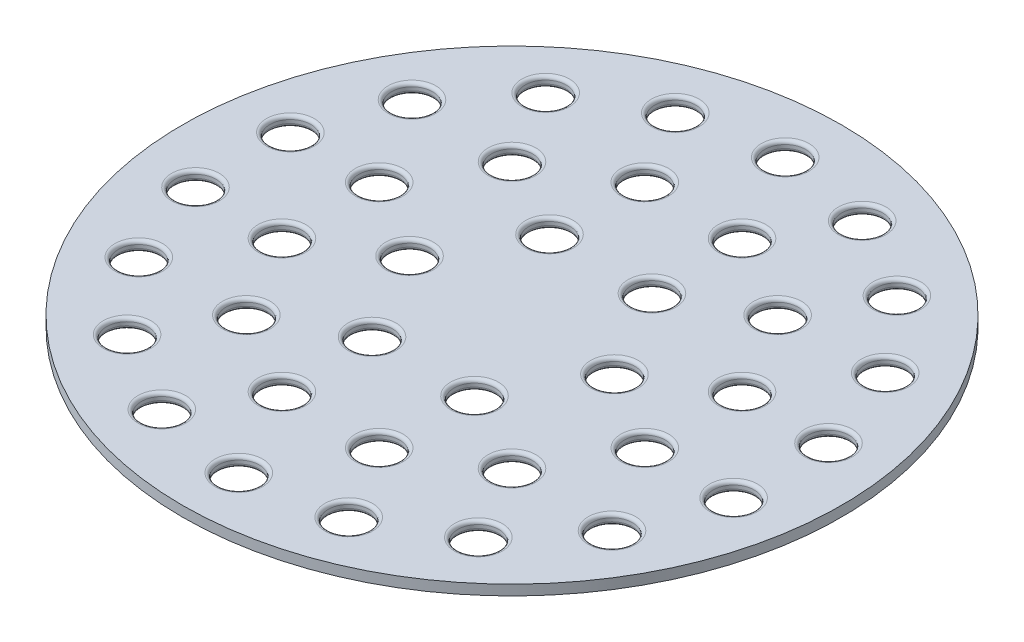
from build123d import *

# Parameters (mm, degrees)
SKETCH1_R           = 96.5
BOSS_EXTRUDE1_DEPTH = 3
SKETCH2_R           = 6
CUT_EXTRUDE3_DEPTH  = 10
FILLET1_R           = 1


with BuildPart() as part:
    # Sketch1 → Boss-Extrude1 (new body)
    with BuildSketch(Plane(origin=(0, 0, 0), x_dir=(1, 0, 0), z_dir=(0, 1, 0))):
        with Locations(Location((0, 0, 0), (0, 0, 270))):
            Circle(SKETCH1_R)
    extrude(amount=BOSS_EXTRUDE1_DEPTH)

    # Sketch2 → Cut-Extrude3 (cut)
    with BuildSketch(Plane(origin=(0, 3, 0), x_dir=(1, 0, 0), z_dir=(0, 1, 0))):
        with Locations(Location((30, 0, 0), (0, 0, 270))):
            Circle(SKETCH2_R)
        with Locations(Location((53.125920446, 14.235047481, 0), (0, 0, 270))):
            Circle(SKETCH2_R)
        with Locations(Location((78.784620241, 13.891854213, 0), (0, 0, 270))):
            Circle(SKETCH2_R)
        with Locations(Location((15, -25.980762114, 0), (0, 0, 270))):
            Circle(SKETCH2_R)
        with Locations(Location((-15, -25.980762114, 0), (0, 0, 270))):
            Circle(SKETCH2_R)
        with Locations(Location((-30, 0, 0), (0, 0, 270))):
            Circle(SKETCH2_R)
        with Locations(Location((-15, 25.980762114, 0), (0, 0, 270))):
            Circle(SKETCH2_R)
        with Locations(Location((15, 25.980762114, 0), (0, 0, 270))):
            Circle(SKETCH2_R)
        with Locations(Location((53.125920446, -14.235047481, 0), (0, 0, 270))):
            Circle(SKETCH2_R)
        with Locations(Location((38.890872965, -38.890872965, 0), (0, 0, 270))):
            Circle(SKETCH2_R)
        with Locations(Location((14.235047481, -53.125920446, 0), (0, 0, 270))):
            Circle(SKETCH2_R)
        with Locations(Location((-14.235047481, -53.125920446, 0), (0, 0, 270))):
            Circle(SKETCH2_R)
        with Locations(Location((-38.890872965, -38.890872965, 0), (0, 0, 270))):
            Circle(SKETCH2_R)
        with Locations(Location((-53.125920446, -14.235047481, 0), (0, 0, 270))):
            Circle(SKETCH2_R)
        with Locations(Location((-53.125920446, 14.235047481, 0), (0, 0, 270))):
            Circle(SKETCH2_R)
        with Locations(Location((-38.890872965, 38.890872965, 0), (0, 0, 270))):
            Circle(SKETCH2_R)
        with Locations(Location((-14.235047481, 53.125920446, 0), (0, 0, 270))):
            Circle(SKETCH2_R)
        with Locations(Location((14.235047481, 53.125920446, 0), (0, 0, 270))):
            Circle(SKETCH2_R)
        with Locations(Location((38.890872965, 38.890872965, 0), (0, 0, 270))):
            Circle(SKETCH2_R)
        with Locations(Location((78.784620241, -13.891854213, 0), (0, 0, 270))):
            Circle(SKETCH2_R)
        with Locations(Location((69.282032303, -40, 0), (0, 0, 270))):
            Circle(SKETCH2_R)
        with Locations(Location((51.423008775, -61.28355545, 0), (0, 0, 270))):
            Circle(SKETCH2_R)
        with Locations(Location((27.361611466, -75.175409663, 0), (0, 0, 270))):
            Circle(SKETCH2_R)
        with Locations(Location((0, -80, 0), (0, 0, 270))):
            Circle(SKETCH2_R)
        with Locations(Location((-27.361611466, -75.175409663, 0), (0, 0, 270))):
            Circle(SKETCH2_R)
        with Locations(Location((-51.423008775, -61.28355545, 0), (0, 0, 270))):
            Circle(SKETCH2_R)
        with Locations(Location((-69.282032303, -40, 0), (0, 0, 270))):
            Circle(SKETCH2_R)
        with Locations(Location((-78.784620241, -13.891854213, 0), (0, 0, 270))):
            Circle(SKETCH2_R)
        with Locations(Location((-78.784620241, 13.891854213, 0), (0, 0, 270))):
            Circle(SKETCH2_R)
        with Locations(Location((-69.282032303, 40, 0), (0, 0, 270))):
            Circle(SKETCH2_R)
        with Locations(Location((-51.423008775, 61.28355545, 0), (0, 0, 270))):
            Circle(SKETCH2_R)
        with Locations(Location((-27.361611466, 75.175409663, 0), (0, 0, 270))):
            Circle(SKETCH2_R)
        with Locations(Location((0, 80, 0), (0, 0, 270))):
            Circle(SKETCH2_R)
        with Locations(Location((27.361611466, 75.175409663, 0), (0, 0, 270))):
            Circle(SKETCH2_R)
        with Locations(Location((51.423008775, 61.28355545, 0), (0, 0, 270))):
            Circle(SKETCH2_R)
        with Locations(Location((69.282032303, 40, 0), (0, 0, 270))):
            Circle(SKETCH2_R)
    extrude(amount=-CUT_EXTRUDE3_DEPTH, mode=Mode.SUBTRACT)

    # Fillet1
    fillet1_edges = [part.edges().sort_by_distance(p)[0] for p in [
        (-30, 0, -6),
        (-30, 3, -6),
        (-15, 0, 19.980762114),
        (-15, 3, 19.980762114),
        (15, 0, 19.980762114),
        (15, 3, 19.980762114),
        (78.784620241, 0, -19.891854213),
        (78.784620241, 3, -19.891854213),
        (53.125920446, 0, -20.235047481),
        (53.125920446, 3, -20.235047481),
        (38.890872965, 0, 32.890872965),
        (38.890872965, 3, 32.890872965),
        (14.235047481, 0, 47.125920446),
        (14.235047481, 3, 47.125920446),
        (-14.235047481, 0, 47.125920446),
        (-14.235047481, 3, 47.125920446),
        (-38.890872965, 0, 32.890872965),
        (-38.890872965, 3, 32.890872965),
        (-53.125920446, 0, 8.235047481),
        (-53.125920446, 3, 8.235047481),
        (-53.125920446, 0, -20.235047481),
        (-53.125920446, 3, -20.235047481),
        (-38.890872965, 0, -44.890872965),
        (-38.890872965, 3, -44.890872965),
        (-14.235047481, 0, -59.125920446),
        (-14.235047481, 3, -59.125920446),
        (27.361611466, 0, -81.175409663),
        (27.361611466, 3, -81.175409663),
        (51.423008775, 0, -67.28355545),
        (51.423008775, 3, -67.28355545),
        (69.282032303, 0, -46),
        (69.282032303, 3, -46),
        (30, 0, -6),
        (30, 3, -6),
        (14.235047481, 0, -59.125920446),
        (14.235047481, 3, -59.125920446),
        (38.890872965, 0, -44.890872965),
        (38.890872965, 3, -44.890872965),
        (78.784620241, 0, 7.891854213),
        (78.784620241, 3, 7.891854213),
        (69.282032303, 0, 34),
        (69.282032303, 3, 34),
        (51.423008775, 0, 55.28355545),
        (51.423008775, 3, 55.28355545),
        (27.361611466, 0, 69.175409663),
        (27.361611466, 3, 69.175409663),
        (0, 0, 74),
        (0, 3, 74),
        (-27.361611466, 0, 69.175409663),
        (-27.361611466, 3, 69.175409663),
        (-51.423008775, 0, 55.28355545),
        (-51.423008775, 3, 55.28355545),
        (-69.282032303, 0, 34),
        (-69.282032303, 3, 34),
        (-78.784620241, 0, 7.891854213),
        (-78.784620241, 3, 7.891854213),
        (-78.784620241, 0, -19.891854213),
        (-78.784620241, 3, -19.891854213),
        (-69.282032303, 0, -46),
        (-69.282032303, 3, -46),
        (-51.423008775, 0, -67.28355545),
        (-51.423008775, 3, -67.28355545),
        (-27.361611466, 0, -81.175409663),
        (-27.361611466, 3, -81.175409663),
        (0, 0, -86),
        (0, 3, -86),
        (53.125920446, 0, 8.235047481),
        (53.125920446, 3, 8.235047481),
        (15, 0, -31.980762114),
        (15, 3, -31.980762114),
        (-15, 0, -31.980762114),
        (-15, 3, -31.980762114),
    ]]
    fillet(fillet1_edges, radius=FILLET1_R)


solid = part.part
